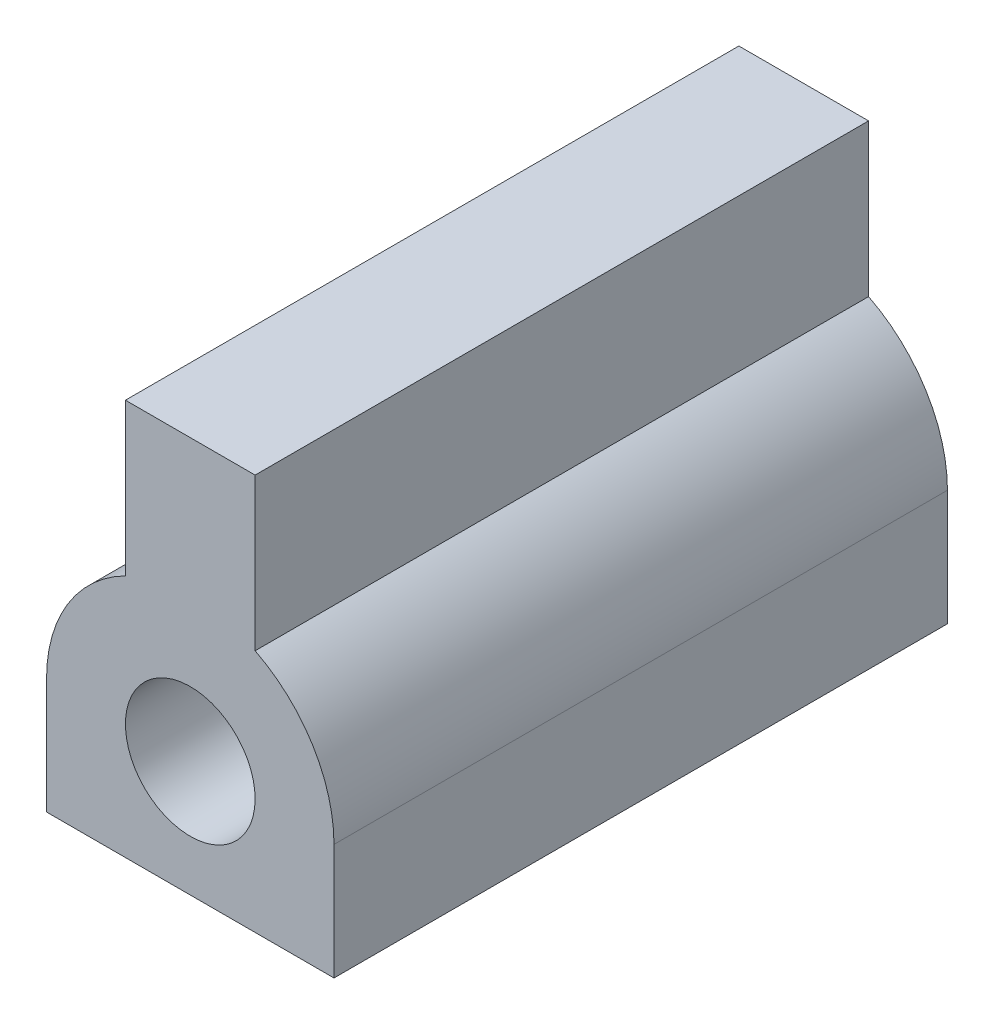
from build123d import *

# Parameters (mm, degrees)
SKETCH1_R           = 4.699
BOSS_EXTRUDE1_DEPTH = 22.225


with BuildPart() as part:
    # Sketch1 → Boss-Extrude1 (new, symmetric)
    with BuildSketch(Plane.XY):
        with BuildLine():
            Line((10.414, -8.382), (-10.414, -8.382))
            Line((-10.414, -8.382), (-10.414, 0))
            ThreePointArc((-10.414, 0), (-8.870929545, 5.455089825), (-4.699, 9.293588919))
            Line((-4.699, 9.293588919), (-4.699, 20.32))
            Line((-4.699, 20.32), (4.699, 20.32))
            Line((4.699, 20.32), (4.699, 9.293588919))
            ThreePointArc((4.699, 9.293588919), (8.870929545, 5.455089825), (10.414, 0))
            Line((10.414, 0), (10.414, -8.382))
        make_face()
        Circle(SKETCH1_R, mode=Mode.SUBTRACT)
    extrude(amount=BOSS_EXTRUDE1_DEPTH, both=True)


solid = part.part
